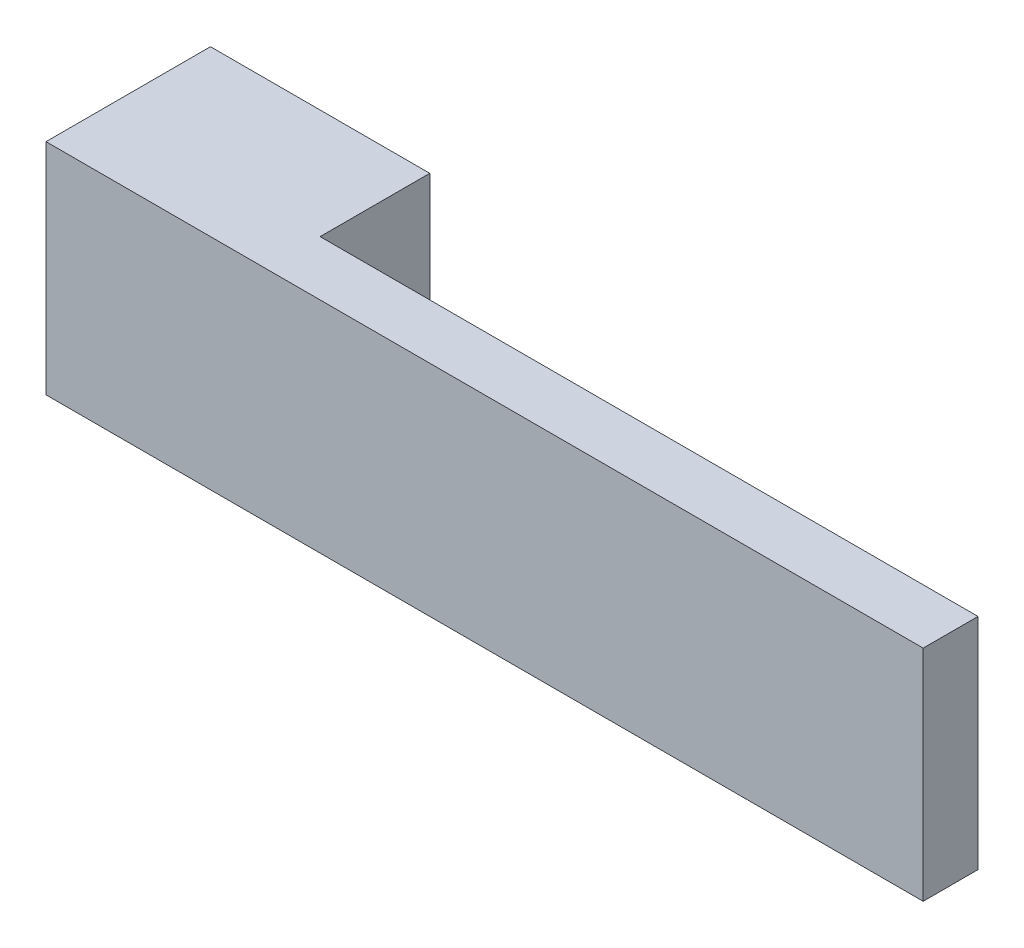
from build123d import *

# Parameters (mm, degrees)
BOSS_EXTRUDE1_DEPTH = 20


with BuildPart() as part:
    # Sketch2 → Boss-Extrude1 (new body)
    with BuildSketch(Plane(origin=(0, 0, 0), x_dir=(1, 0, 0), z_dir=(0, 1, 0))):
        Polygon((0, -15), (0, 0), (20, 0), (20, -10), (80, -10), (80, -15), align=None)
    extrude(amount=BOSS_EXTRUDE1_DEPTH)


solid = part.part
